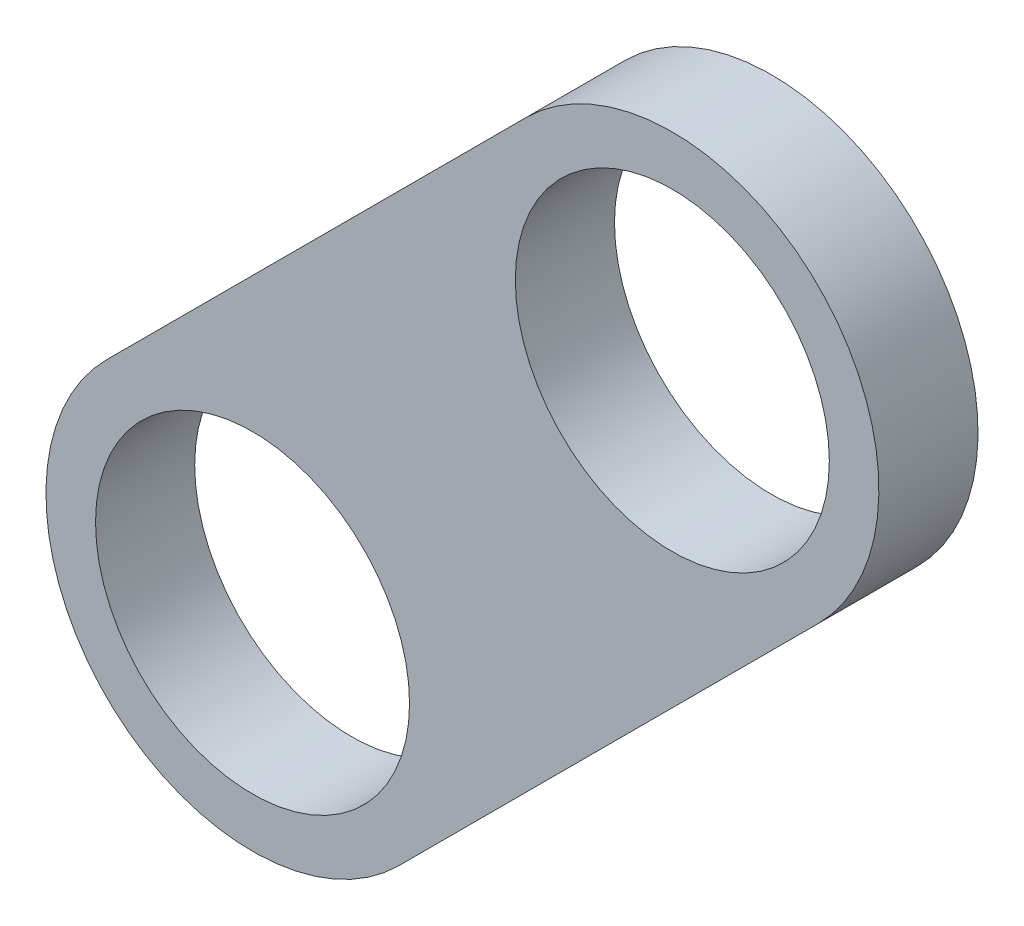
from build123d import *

# Parameters (mm, degrees)
SKETCH1_R           = 9.5
BOSS_EXTRUDE1_DEPTH = 6


with BuildPart() as part:
    # Sketch1 → Boss-Extrude1 (new body)
    with BuildSketch(Plane.XY):
        with BuildLine():
            Line((-8.838834765, 8.838834765), (16.561165235, 34.238834765))
            ThreePointArc((16.561165235, 34.238834765), (34.238834765, 34.238834765), (34.238834765, 16.561165235))
            Line((34.238834765, 16.561165235), (8.838834765, -8.838834765))
            ThreePointArc((8.838834765, -8.838834765), (-8.838834765, -8.838834765), (-8.838834765, 8.838834765))
        make_face()
        Circle(SKETCH1_R, mode=Mode.SUBTRACT)
        with Locations((25.4, 25.4)):
            Circle(SKETCH1_R, mode=Mode.SUBTRACT)
    extrude(amount=BOSS_EXTRUDE1_DEPTH)


solid = part.part
